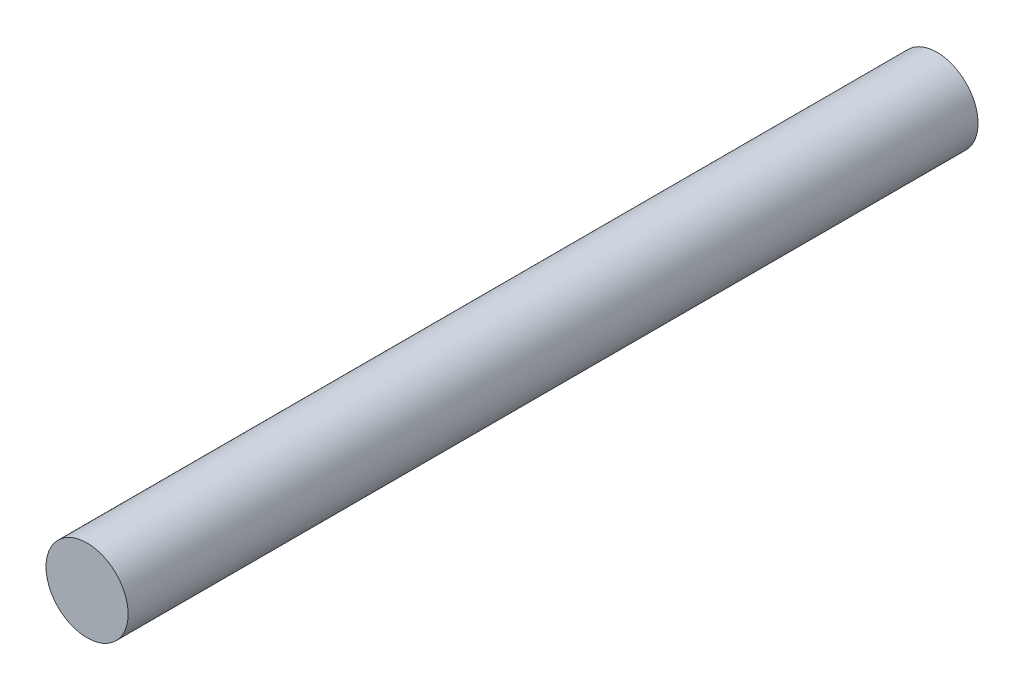
from build123d import *

# Parameters (mm, degrees)
SKETCH1_R           = 4.7625
BOSS_EXTRUDE1_DEPTH = 98.552


with BuildPart() as part:
    # Sketch1 → Boss-Extrude1 (new body)
    with BuildSketch(Plane.XY):
        with Locations(Location((0, 0, 0), (0, 0, 180))):
            Circle(SKETCH1_R)
    extrude(amount=BOSS_EXTRUDE1_DEPTH)


solid = part.part
